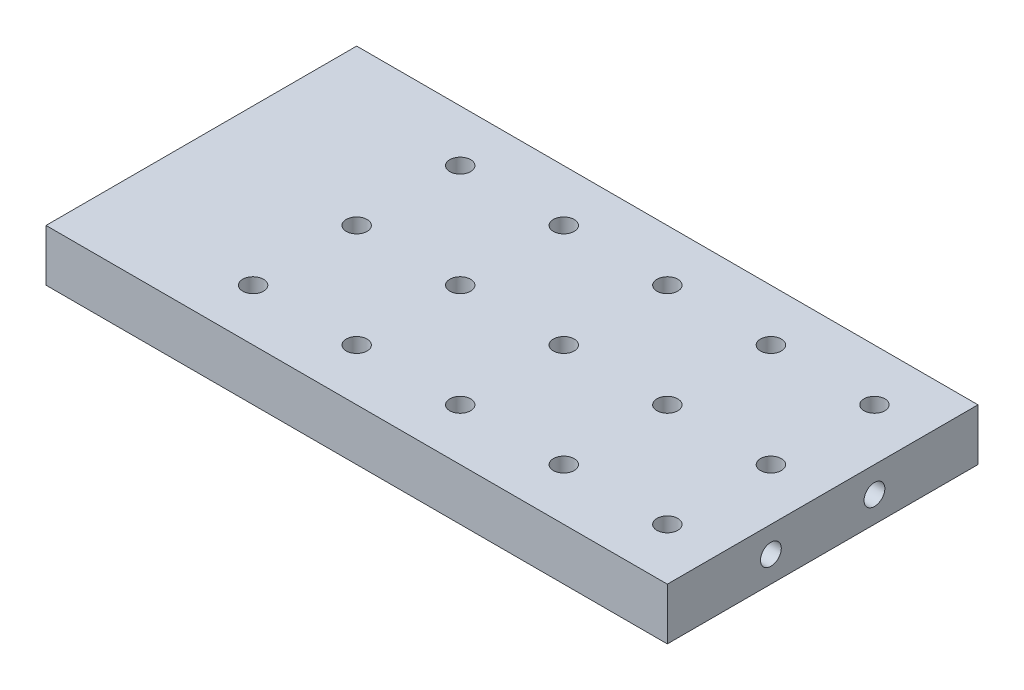
from build123d import *

# Parameters (mm, degrees)
SKETCH1_W                       = 152.4
SKETCH1_H                       = 76.2
BOSS_EXTRUDE1_DEPTH             = 6.35
TAP_DRILL_FOR_1_4_20_TAP1_D     = 5.1054
TAP_DRILL_FOR_1_4_20_TAP2_D     = 5.1054
TAP_DRILL_FOR_1_4_20_TAP2_DEPTH = 12.7
TAP_DRILL_FOR_1_4_20_TAP2_TIP   = 1.533816902
TAP_DRILL_FOR_1_4_20_TAP3_D     = 5.1054
TAP_DRILL_FOR_1_4_20_TAP3_DEPTH = 12.7
TAP_DRILL_FOR_1_4_20_TAP3_TIP   = 1.533816902


with BuildPart() as part:
    # Sketch1 → Boss-Extrude1 (new, symmetric)
    with BuildSketch(Plane(origin=(0, 0, 0), x_dir=(1, 0, 0), z_dir=(0, 1, 0))):
        Rectangle(SKETCH1_W, SKETCH1_H)
    extrude(amount=BOSS_EXTRUDE1_DEPTH, both=True)

    # Tap Drill for 1/4-20 Tap1 (through all)
    with Locations(Plane(origin=(0, 6.35, 0), x_dir=(1, 0, 0), z_dir=(0, 1, 0))):
        with Locations((63.5, 25.4), (38.1, 25.4), (12.7, 25.4), (38.1, 0), (12.7, 0), (38.1, -25.4), (12.7, -25.4), (63.5, 0), (63.5, -25.4), (-12.7, 25.4), (-38.1, 25.4), (-12.7, 0), (-38.1, 0), (-12.7, -25.4), (-38.1, -25.4)):
            Hole(TAP_DRILL_FOR_1_4_20_TAP1_D / 2)

    # Tap Drill for 1/4-20 Tap2
    with Locations(Plane.ZY.offset(76.2)):
        with Locations((-25.4, 0), (0, 0), (25.4, 0)):
            Hole(TAP_DRILL_FOR_1_4_20_TAP2_D / 2, depth=TAP_DRILL_FOR_1_4_20_TAP2_DEPTH)
            with Locations((0, 0, -(TAP_DRILL_FOR_1_4_20_TAP2_DEPTH + TAP_DRILL_FOR_1_4_20_TAP2_TIP / 2))):  # 118° drill point
                Cone(0, TAP_DRILL_FOR_1_4_20_TAP2_D / 2, TAP_DRILL_FOR_1_4_20_TAP2_TIP, mode=Mode.SUBTRACT)

    # Tap Drill for 1/4-20 Tap3
    with Locations(Plane(origin=(76.2, 0, 0), x_dir=(0, 0, -1), z_dir=(1, 0, 0))):
        with Locations((12.7, 0), (-12.7, 0)):
            Hole(TAP_DRILL_FOR_1_4_20_TAP3_D / 2, depth=TAP_DRILL_FOR_1_4_20_TAP3_DEPTH)
            with Locations((0, 0, -(TAP_DRILL_FOR_1_4_20_TAP3_DEPTH + TAP_DRILL_FOR_1_4_20_TAP3_TIP / 2))):  # 118° drill point
                Cone(0, TAP_DRILL_FOR_1_4_20_TAP3_D / 2, TAP_DRILL_FOR_1_4_20_TAP3_TIP, mode=Mode.SUBTRACT)


solid = part.part
